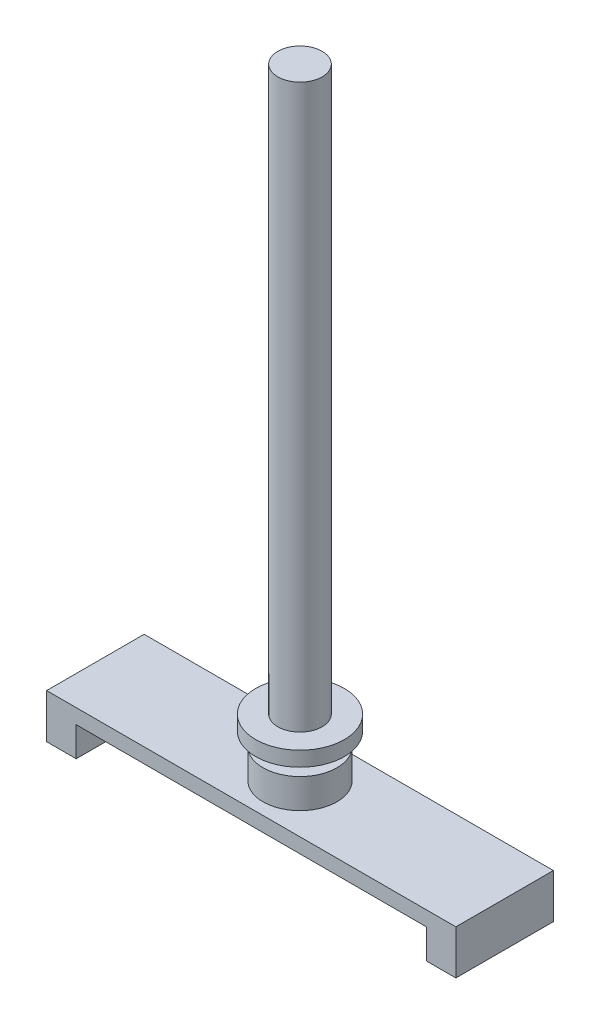
from build123d import *

# Parameters (mm, degrees)
BOSS_EXTRUDE1_DEPTH      = 33
BOSS_EXTRUDE1_DEPTH_BACK = 33
SKETCH2_W                = 10
SKETCH2_H                = 63
CUT_EXTRUDE1_DEPTH       = 20
SKETCH3_R                = 25
BOSS_EXTRUDE2_DEPTH      = 20
SKETCH4_R                = 15
BOSS_EXTRUDE3_DEPTH      = 400
SKETCH5_R                = 30
BOSS_EXTRUDE4_DEPTH      = 10


with BuildPart() as part:
    # Sketch1 → Boss-Extrude1 (new, two sides: drawn at the far end of the back side and taken through both)
    with BuildSketch(Plane.XY.offset(-BOSS_EXTRUDE1_DEPTH_BACK)):
        Polygon((-138.5, 0), (138.5, 0), (138.5, -30), (118.5, -30), (118.5, -10), (-118.5, -10), (-118.5, -30), (-138.5, -30), align=None)
    extrude(amount=BOSS_EXTRUDE1_DEPTH + BOSS_EXTRUDE1_DEPTH_BACK)

    # Sketch2 → Cut-Extrude1 (cut)
    with BuildSketch(Plane.XZ.offset(30)):
        with Locations((-128.5, 0)):
            Rectangle(SKETCH2_W, SKETCH2_H)
        with Locations((128.5, 0)):
            Rectangle(SKETCH2_W, SKETCH2_H)
    extrude(amount=-CUT_EXTRUDE1_DEPTH, mode=Mode.SUBTRACT)

    # Sketch3 → Boss-Extrude2 (add)
    with BuildSketch(Plane(origin=(0, 0, 0), x_dir=(1, 0, 0), z_dir=(0, 1, 0))):
        Circle(SKETCH3_R)
    extrude(amount=BOSS_EXTRUDE2_DEPTH)

    # Sketch4 → Boss-Extrude3 (add)
    with BuildSketch(Plane(origin=(0, 20, 0), x_dir=(1, 0, 0), z_dir=(0, 1, 0))):
        Circle(SKETCH4_R)
    extrude(amount=BOSS_EXTRUDE3_DEPTH)

    # Sketch5 → Boss-Extrude4 (add)
    with BuildSketch(Plane(origin=(0, 29, 0), x_dir=(1, 0, 0), z_dir=(0, 1, 0))):
        Circle(SKETCH5_R)
    extrude(amount=BOSS_EXTRUDE4_DEPTH)


solid = part.part
